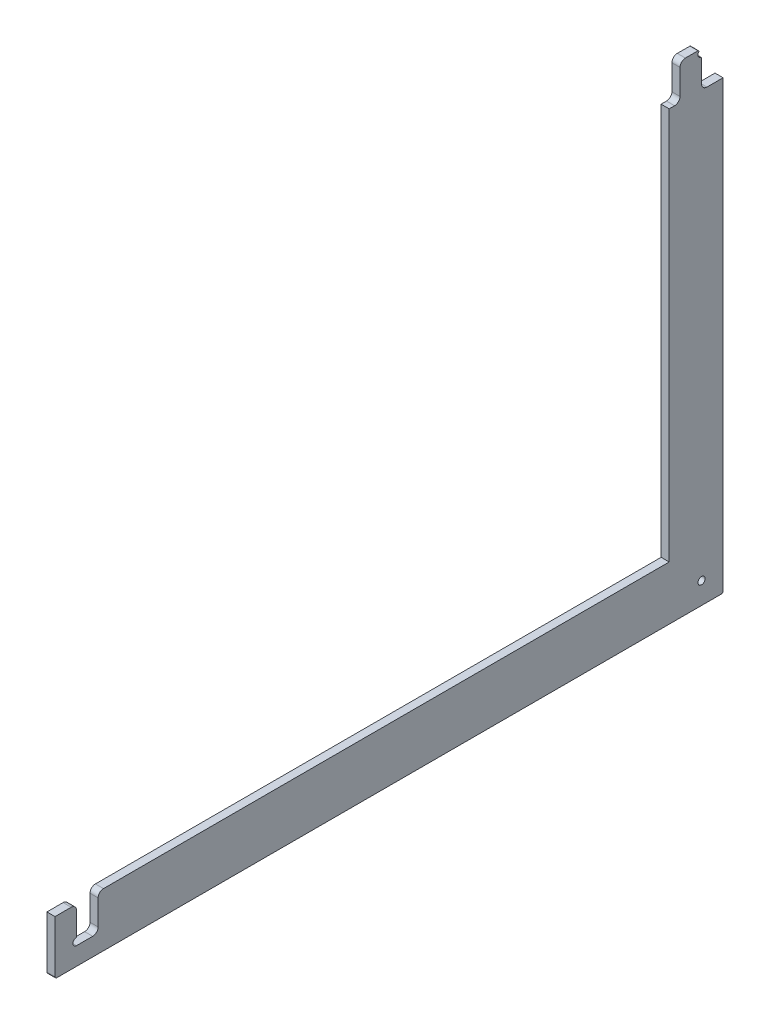
from build123d import *

# Parameters (mm, degrees)
SKETCH2_R           = 2
BOSS_EXTRUDE1_DEPTH = 4.5
SKETCH3_R           = 2
CUT_EXTRUDE1_DEPTH  = 459.798975587
FILLET2_R           = 0.5
FILLET4_R           = 0.5
FILLET5_R           = 0.5
FILLET6_R           = 3
FILLET7_R           = 3
FILLET8_R           = 1


with BuildPart() as part:
    # Sketch2 → Boss-Extrude1 (new body)
    with BuildSketch(Plane(origin=(0, 0, 0), x_dir=(0, 0, -1), z_dir=(1, 0, 0))):
        Polygon((-30, 30), (-30, 248.5), (-24, 248.5), (-24, 268.5), (-12, 268.5), (-12, 248.5), (0, 248.5), (0, 0), (-372, 0), (-372, 30), (-360, 30), (-360, 10), (-348, 10), (-348, 30), align=None)
        with Locations((-12, 12)):
            Circle(SKETCH2_R, mode=Mode.SUBTRACT)
    extrude(amount=BOSS_EXTRUDE1_DEPTH)

    # Sketch3 → Cut-Extrude1 (cut, through all)
    with BuildSketch(Plane(origin=(4.5, 0, 0), x_dir=(0, 0, -1), z_dir=(1, 0, 0))):
        with Locations((-12, 266.5)):
            Circle(SKETCH3_R)
        with Locations((-360, 12)):
            Circle(SKETCH3_R)
    extrude(amount=-CUT_EXTRUDE1_DEPTH, mode=Mode.SUBTRACT)

    # Fillet2
    fillet2_edges = [part.edges().sort_by_distance(p)[0] for p in [
        (2.25, 264.5, 12),
    ]]
    fillet(fillet2_edges, radius=FILLET2_R)

    # Fillet4
    fillet4_edges = [part.edges().sort_by_distance(p)[0] for p in [
        (2.25, 268.5, 12),
    ]]
    fillet(fillet4_edges, radius=FILLET4_R)

    # Fillet5
    fillet5_edges = [part.edges().sort_by_distance(p)[0] for p in [
        (2.25, 14, 360),
    ]]
    fillet(fillet5_edges, radius=FILLET5_R)

    # Fillet6
    fillet6_edges = [part.edges().sort_by_distance(p)[0] for p in [
        (2.25, 30, 360),
        (2.25, 30, 348),
        (2.25, 248.5, 24),
        (2.25, 248.5, 12),
    ]]
    fillet(fillet6_edges, radius=FILLET6_R)

    # Fillet7
    fillet7_edges = [part.edges().sort_by_distance(p)[0] for p in [
        (2.25, 10, 348),
        (2.25, 268.5, 24),
    ]]
    fillet(fillet7_edges, radius=FILLET7_R)

    # Fillet8
    fillet8_edges = [part.edges().sort_by_distance(p)[0] for p in [
        (2.25, 0, 0),
        (2.25, 0, 372),
    ]]
    fillet(fillet8_edges, radius=FILLET8_R)


solid = part.part
